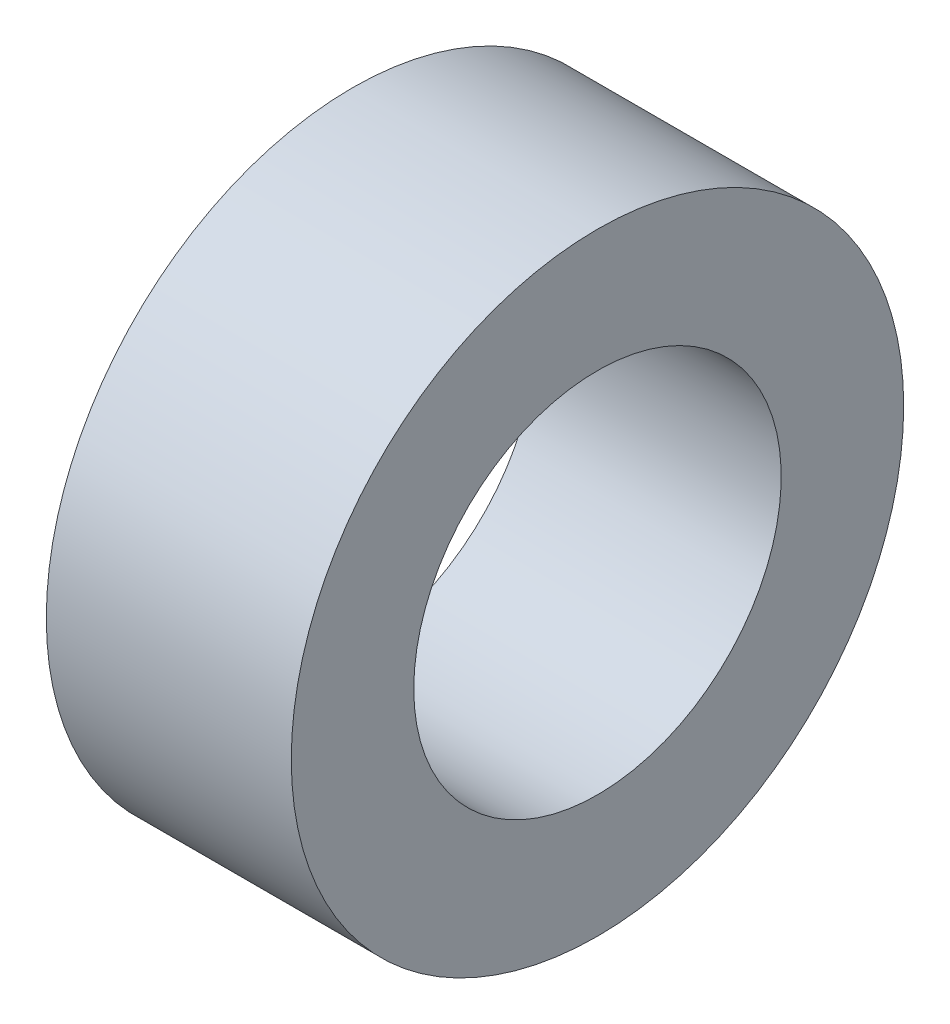
from build123d import *

# Parameters (mm, degrees)
SKETCH1_W = 2
SKETCH1_H = 1


with BuildPart() as part:
    # Sketch1 → Revolve1 (revolve)
    with BuildSketch(Plane.XY, mode=Mode.PRIVATE) as revolve1_sk:
        with Locations((0, 2)):
            Rectangle(SKETCH1_W, SKETCH1_H)
    revolve(revolve1_sk.sketch.rotate(Axis((0, 0, 0), (1, 0, 0)), 90), axis=Axis((0, 0, 0), (1, 0, 0)))


solid = part.part
